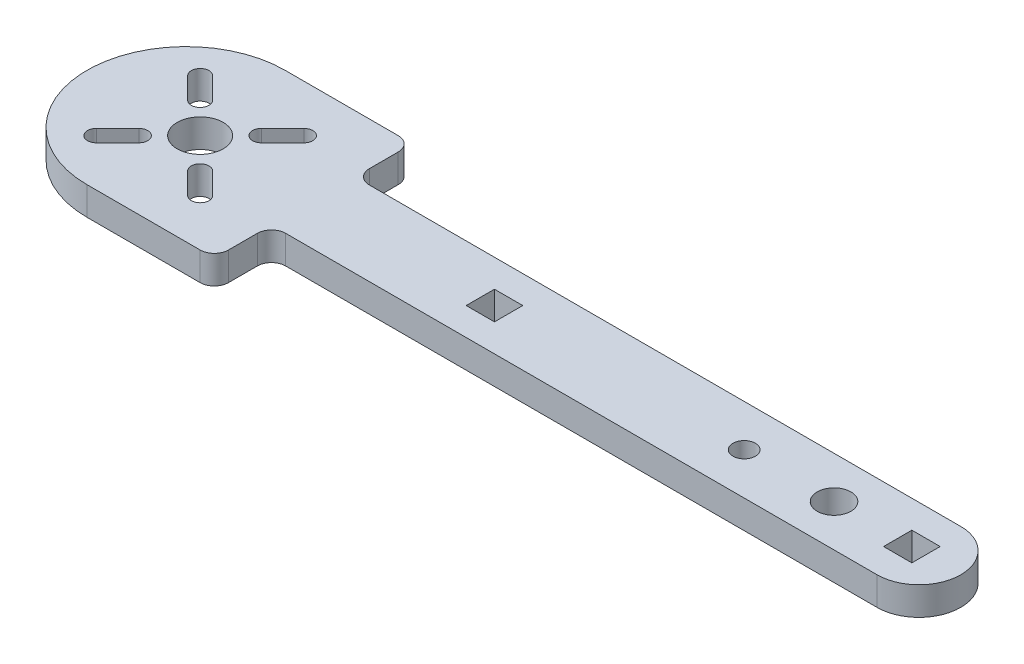
from build123d import *

# Parameters (mm, degrees)
SKETCH1_R           = 3.25
SKETCH1_R_2         = 2.38125
SKETCH1_R_3         = 1.5875
SKETCH1_W           = 4
SKETCH1_H           = 4
BOSS_EXTRUDE1_DEPTH = 4


with BuildPart() as part:
    # Sketch1 → Boss-Extrude1 (new body)
    with BuildSketch(Plane(origin=(0, 0, 0), x_dir=(1, 0, 0), z_dir=(0, 1, 0))):
        with BuildLine():
            Line((-50.8, 14), (-36.8, 14))
            ThreePointArc((-36.8, 14), (-35.385786438, 13.414213562), (-34.8, 12))
            Line((-34.8, 12), (-34.8, 7.914556152))
            ThreePointArc((-34.8, 7.914556152), (-34.214213562, 6.500342589), (-32.8, 5.914556152))
            Line((-32.8, 5.914556152), (50.8, 5.914556152))
            ThreePointArc((50.8, 5.914556152), (56.714556152, 0), (50.8, -5.914556152))
            Line((50.8, -5.914556152), (-32.8, -5.914556152))
            ThreePointArc((-32.8, -5.914556152), (-34.214213562, -6.500342589), (-34.8, -7.914556152))
            Line((-34.8, -7.914556152), (-34.8, -12))
            ThreePointArc((-34.8, -12), (-35.385786438, -13.414213562), (-36.8, -14))
            Line((-36.8, -14), (-50.8, -14))
            Line((-50.8, -14), (-52.8, -14))
            ThreePointArc((-52.8, -14), (-66.8, 0), (-52.8, 14))
            Line((-52.8, 14), (-50.8, 14))
        make_face()
        with Locations(Location((-50.8, 0, 0), (0, 0, 270))):
            Circle(SKETCH1_R, mode=Mode.SUBTRACT)
        with Locations(Location((38.8, 0, 0), (0, 0, 270))):
            Circle(SKETCH1_R_2, mode=Mode.SUBTRACT)
        with Locations(Location((26.1, 0, 0), (0, 0, 270))):
            Circle(SKETCH1_R_3, mode=Mode.SUBTRACT)
        with BuildLine():
            Line((-57.252349378, 8.220116331), (-54.247145558, 5.214912511))
            ThreePointArc((-54.247145558, 5.214912511), (-54.247145558, 3.447145558), (-56.014912511, 3.447145558))
            Line((-56.014912511, 3.447145558), (-59.020116331, 6.452349378))
            ThreePointArc((-59.020116331, 6.452349378), (-59.020116331, 8.220116331), (-57.252349378, 8.220116331))
        make_face(mode=Mode.SUBTRACT)
        with BuildLine():
            Line((-42.579883669, 6.452349378), (-45.585087489, 3.447145558))
            ThreePointArc((-45.585087489, 3.447145558), (-47.352854442, 3.447145558), (-47.352854442, 5.214912511))
            Line((-47.352854442, 5.214912511), (-44.347650622, 8.220116331))
            ThreePointArc((-44.347650622, 8.220116331), (-42.579883669, 8.220116331), (-42.579883669, 6.452349378))
        make_face(mode=Mode.SUBTRACT)
        with BuildLine():
            Line((-44.347650622, -8.220116331), (-47.352854442, -5.214912511))
            ThreePointArc((-47.352854442, -5.214912511), (-47.352854442, -3.447145558), (-45.585087489, -3.447145558))
            Line((-45.585087489, -3.447145558), (-42.579883669, -6.452349378))
            ThreePointArc((-42.579883669, -6.452349378), (-42.579883669, -8.220116331), (-44.347650622, -8.220116331))
        make_face(mode=Mode.SUBTRACT)
        with BuildLine():
            Line((-59.020116331, -6.452349378), (-56.014912511, -3.447145558))
            ThreePointArc((-56.014912511, -3.447145558), (-54.247145558, -3.447145558), (-54.247145558, -5.214912511))
            Line((-54.247145558, -5.214912511), (-57.252349378, -8.220116331))
            ThreePointArc((-57.252349378, -8.220116331), (-59.020116331, -8.220116331), (-59.020116331, -6.452349378))
        make_face(mode=Mode.SUBTRACT)
        with Locations((49.8, 0)):
            Rectangle(SKETCH1_W, SKETCH1_H, mode=Mode.SUBTRACT)
        with Locations((-9.2, 0)):
            Rectangle(SKETCH1_W, SKETCH1_H, mode=Mode.SUBTRACT)
    extrude(amount=BOSS_EXTRUDE1_DEPTH)


solid = part.part
